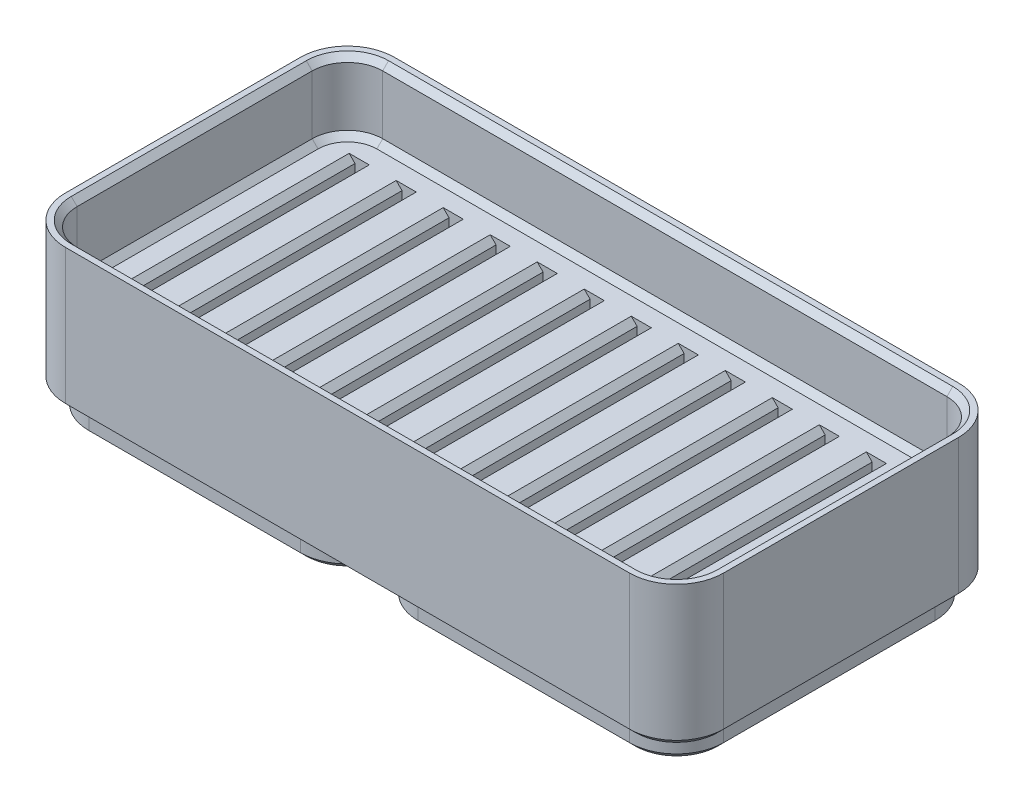
from build123d import *

# Parameters (mm, degrees)
BOSS_EXTRUDE4_DEPTH = 5
SKETCH6_W           = 70
SKETCH6_H           = 70
BOSS_EXTRUDE5_DEPTH = 30
SKETCH8_R           = 3
CUT_EXTRUDE1_DEPTH  = 2
CUT_EXTRUDE2_START  = -30
CUT_EXTRUDE2_DEPTH  = 30
SKETCH10_W          = 140
SKETCH10_H          = 70
BOSS_EXTRUDE6_DEPTH = 2.5
FILLET1_R           = 10
SKETCH11_W          = 202.57423707
SKETCH11_H          = 181.335779968
CUT_EXTRUDE3_DEPTH  = 27.5
SKETCH12_W          = 1.775
SKETCH12_H          = 55
BOSS_EXTRUDE9_DEPTH = 27.5
CUT_EXTRUDE4_DEPTH  = 15
CHAMFER2_SIZE       = 1.25
CHAMFER4_SIZE       = 1.25
CHAMFER5_SIZE       = 1.25


with BuildPart() as part:
    # Sketch5 → Boss-Extrude4 (new body)
    with BuildSketch(Plane(origin=(0, 0, 0), x_dir=(1, 0, 0), z_dir=(0, 1, 0))):
        with BuildLine():
            Line((-22.5, -32.5), (22.5, -32.5))
            ThreePointArc((22.5, -32.5), (29.571067812, -29.571067812), (32.5, -22.5))
            Line((32.5, -22.5), (32.5, 22.5))
            ThreePointArc((32.5, 22.5), (29.571067812, 29.571067812), (22.5, 32.5))
            Line((22.5, 32.5), (-22.5, 32.5))
            ThreePointArc((-22.5, 32.5), (-29.571067812, 29.571067812), (-32.5, 22.5))
            Line((-32.5, 22.5), (-32.5, -22.5))
            ThreePointArc((-32.5, -22.5), (-29.571067812, -29.571067812), (-22.5, -32.5))
        make_face()
    extrude(amount=BOSS_EXTRUDE4_DEPTH)

    # Sketch6 → Boss-Extrude5 (add)
    with BuildSketch(Plane(origin=(0, 5, 0), x_dir=(1, 0, 0), z_dir=(0, 1, 0))):
        Rectangle(SKETCH6_W, SKETCH6_H)
    extrude(amount=BOSS_EXTRUDE5_DEPTH)

    # Sketch8 → Cut-Extrude1 (cut)
    with BuildSketch(Plane.XZ):
        with Locations(Location((26.037533906, -26.035533906, 0), (0, 0, 270))):
            Circle(SKETCH8_R)
        with Locations(Location((26.036533906, 26.036533906, 0), (0, 0, 270))):
            Circle(SKETCH8_R)
        with BuildLine():
            ThreePointArc((-23.035533906, 26.035533906), (-24.887483609, 28.807172503), (-28.156854249, 28.156854249))
            Line((-28.156854249, 28.156854249), (-23.914213562, 23.914213562))
            ThreePointArc((-23.914213562, 23.914213562), (-23.263895308, 24.887483609), (-23.035533906, 26.035533906))
        make_face()
        with BuildLine():
            Line((-23.914213562, 23.914213562), (-28.156854249, 28.156854249))
            ThreePointArc((-28.156854249, 28.156854249), (-28.156854249, 23.914213562), (-23.914213562, 23.914213562))
        make_face()
        with Locations(Location((-26.034533906, -26.036533906, 0), (0, 0, 270))):
            Circle(SKETCH8_R)
    extrude(amount=-CUT_EXTRUDE1_DEPTH, mode=Mode.SUBTRACT)

    # Mirror1: part across plane


with BuildPart() as part_1:
    add(part.part)
    add(part.part.mirror(Plane(origin=(-35, 35, -35), x_dir=(0, 0, 1), z_dir=(1, 0, 0))))

    # Sketch9 → Cut-Extrude2 (cut)
    with BuildSketch(Plane(origin=(0, 35, 0), x_dir=(1, 0, 0), z_dir=(0, 1, 0)).offset(CUT_EXTRUDE2_START)):
        with BuildLine():
            Line((22.5, 32.5), (-92.5, 32.5))
            ThreePointArc((-92.5, 32.5), (-99.571067812, 29.571067812), (-102.5, 22.5))
            Line((-102.5, 22.5), (-102.5, -22.5))
            ThreePointArc((-102.5, -22.5), (-99.571067812, -29.571067812), (-92.5, -32.5))
            Line((-92.5, -32.5), (22.5, -32.5))
            ThreePointArc((22.5, -32.5), (29.571067812, -29.571067812), (32.5, -22.5))
            Line((32.5, -22.5), (32.5, 22.5))
            ThreePointArc((32.5, 22.5), (29.571067812, 29.571067812), (22.5, 32.5))
        make_face()
    extrude(amount=CUT_EXTRUDE2_DEPTH, mode=Mode.SUBTRACT)


with BuildPart() as cut_extrude2_piece_1:
    # of the separate pieces the step leaves, piece 1, a body of its own (cut_extrude2_pieces)
    add(part_1.part.solids().sort_by_distance((35, 5, -35))[0])



with BuildPart() as cut_extrude2_piece_2:
    # of the separate pieces the step leaves, piece 2, a body of its own (cut_extrude2_pieces)
    add(part_1.part.solids().sort_by_distance((-22.5, 0, 32.5))[0])


with BuildPart() as cut_extrude2_piece_3:
    # of the separate pieces the step leaves, piece 3, a body of its own (cut_extrude2_pieces)
    add(part_1.part.solids().sort_by_distance((-92.5, 0, -32.5))[0])


with BuildPart() as cut_extrude2_piece_1_1:
    add(cut_extrude2_piece_1.part)

    add(cut_extrude2_piece_2.part)  # Boss-Extrude6 merges Cut-Extrude2 piece 2

    add(cut_extrude2_piece_3.part)  # Boss-Extrude6 merges Cut-Extrude2 piece 3
    # Sketch10 → Boss-Extrude6 (add)
    with BuildSketch(Plane.XZ.offset(-5)):
        with Locations((-35, 0)):
            Rectangle(SKETCH10_W, SKETCH10_H)
    extrude(amount=-BOSS_EXTRUDE6_DEPTH)

    # Fillet1
    fillet1_edges = [cut_extrude2_piece_1_1.edges().sort_by_distance(p)[0] for p in [
        (35, 20, 35),
        (35, 20, -35),
        (-105, 20, 35),
        (-105, 20, -35),
    ]]
    fillet(fillet1_edges, radius=FILLET1_R)

    # Sketch11 → Cut-Extrude3 (cut)
    with BuildSketch(Plane(origin=(0, 35, 0), x_dir=(1, 0, 0), z_dir=(0, 1, 0))):
        with Locations((-35, 32.5)):
            Rectangle(SKETCH11_W, SKETCH11_H)
    extrude(amount=-CUT_EXTRUDE3_DEPTH, mode=Mode.SUBTRACT)

    # Sketch12 → Boss-Extrude9 (add)
    with BuildSketch(Plane(origin=(0, 7.5, 0), x_dir=(1, 0, 0), z_dir=(0, 1, 0))):
        with BuildLine():
            Line((-105, 25), (-105, -25))
            ThreePointArc((-105, -25), (-102.071067812, -32.071067812), (-95, -35))
            Line((-95, -35), (25, -35))
            ThreePointArc((25, -35), (32.071067812, -32.071067812), (35, -25))
            Line((35, -25), (35, 25))
            ThreePointArc((35, 25), (32.071067812, 32.071067812), (25, 35))
            Line((25, 35), (-95, 35))
            ThreePointArc((-95, 35), (-102.071067812, 32.071067812), (-105, 25))
        make_face()
        with Locations((-85, 0)):
            Rectangle(SKETCH12_W, SKETCH12_H, mode=Mode.SUBTRACT)
        with Locations((-75, 0)):
            Rectangle(SKETCH12_W, SKETCH12_H, mode=Mode.SUBTRACT)
        with Locations((-65, 0)):
            Rectangle(SKETCH12_W, SKETCH12_H, mode=Mode.SUBTRACT)
        with Locations((-55, 0)):
            Rectangle(SKETCH12_W, SKETCH12_H, mode=Mode.SUBTRACT)
        with Locations((-45, 0)):
            Rectangle(SKETCH12_W, SKETCH12_H, mode=Mode.SUBTRACT)
        with Locations((-35, 0)):
            Rectangle(SKETCH12_W, SKETCH12_H, mode=Mode.SUBTRACT)
        with Locations((-95, 0)):
            Rectangle(SKETCH12_W, SKETCH12_H, mode=Mode.SUBTRACT)
        with Locations((-25, 0)):
            Rectangle(SKETCH12_W, SKETCH12_H, mode=Mode.SUBTRACT)
        with Locations((-15, 0)):
            Rectangle(SKETCH12_W, SKETCH12_H, mode=Mode.SUBTRACT)
        with Locations((-5, 0)):
            Rectangle(SKETCH12_W, SKETCH12_H, mode=Mode.SUBTRACT)
        with Locations((5, 0)):
            Rectangle(SKETCH12_W, SKETCH12_H, mode=Mode.SUBTRACT)
        with Locations((15, 0)):
            Rectangle(SKETCH12_W, SKETCH12_H, mode=Mode.SUBTRACT)
        with Locations((25, 0)):
            Rectangle(SKETCH12_W, SKETCH12_H, mode=Mode.SUBTRACT)
    extrude(amount=BOSS_EXTRUDE9_DEPTH)

    # Sketch13 → Cut-Extrude4 (cut)
    with BuildSketch(Plane(origin=(0, 35, 0), x_dir=(1, 0, 0), z_dir=(0, 1, 0))):
        with BuildLine():
            Line((32.5, -25), (32.5, 25))
            ThreePointArc((32.5, 25), (30.303300859, 30.303300859), (25, 32.5))
            Line((25, 32.5), (-95, 32.5))
            ThreePointArc((-95, 32.5), (-100.303300859, 30.303300859), (-102.5, 25))
            Line((-102.5, 25), (-102.5, -25))
            ThreePointArc((-102.5, -25), (-100.303300859, -30.303300859), (-95, -32.5))
            Line((-95, -32.5), (25, -32.5))
            ThreePointArc((25, -32.5), (30.303300859, -30.303300859), (32.5, -25))
        make_face()
    extrude(amount=-CUT_EXTRUDE4_DEPTH, mode=Mode.SUBTRACT)

    # Chamfer2
    chamfer2_edges = [cut_extrude2_piece_1_1.edges().sort_by_distance(p)[0] for p in [
        (30.303300859, 20, -30.303300859),
        (32.5, 20, 0),
        (30.303300859, 20, 30.303300859),
        (-35, 20, 32.5),
        (-100.303300859, 20, 30.303300859),
        (-102.5, 20, 0),
        (-100.303300859, 20, -30.303300859),
        (-35, 20, -32.5),
        (30.303300859, 35, -30.303300859),
        (-35, 35, -32.5),
        (-100.303300859, 35, -30.303300859),
        (-102.5, 35, 0),
        (-100.303300859, 35, 30.303300859),
        (-35, 35, 32.5),
        (30.303300859, 35, 30.303300859),
        (32.5, 35, 0),
    ]]
    chamfer(chamfer2_edges, length=CHAMFER2_SIZE)

    # Chamfer4
    chamfer4_edges = [cut_extrude2_piece_1_1.edges().sort_by_distance(p)[0] for p in [
        (-29.571067812, 0, 29.571067812),
        (0, 0, 32.5),
        (29.571067812, 0, 29.571067812),
        (32.5, 0, 0),
        (29.571067812, 0, -29.571067812),
        (0, 0, -32.5),
        (-29.571067812, 0, -29.571067812),
        (-32.5, 0, 0),
        (-40.428932188, 0, 29.571067812),
        (-70, 0, 32.5),
        (-99.571067812, 0, 29.571067812),
        (-102.5, 0, 0),
        (-99.571067812, 0, -29.571067812),
        (-70, 0, -32.5),
        (-40.428932188, 0, -29.571067812),
        (-37.5, 0, 0),
        (-35, 5, -35),
        (-35, 5, 35),
        (-105, 5, 0),
        (35, 5, 0),
        (-102.071067812, 5, -32.071067812),
        (-102.071067812, 5, 32.071067812),
        (32.071067812, 5, 32.071067812),
        (32.071067812, 5, -32.071067812),
    ]]
    chamfer(chamfer4_edges, length=CHAMFER4_SIZE)

    # Chamfer5
    chamfer5_edges = [cut_extrude2_piece_1_1.edges().sort_by_distance(p)[0] for p in [
        (25.8875, 20, 0),
        (-94.1125, 20, 0),
        (-95.8875, 20, 0),
        (-84.1125, 20, 0),
        (-85.8875, 20, 0),
        (-74.1125, 20, 0),
        (-75.8875, 20, 0),
        (-64.1125, 20, 0),
        (-65.8875, 20, 0),
        (-54.1125, 20, 0),
        (-55.8875, 20, 0),
        (-44.1125, 20, 0),
        (-45.8875, 20, 0),
        (-34.1125, 20, 0),
        (-35.8875, 20, 0),
        (-24.1125, 20, 0),
        (-25.8875, 20, 0),
        (-14.1125, 20, 0),
        (-15.8875, 20, 0),
        (-4.1125, 20, 0),
        (-5.8875, 20, 0),
        (5.8875, 20, 0),
        (4.1125, 20, 0),
        (15.8875, 20, 0),
        (14.1125, 20, 0),
        (24.1125, 20, 0),
    ]]
    chamfer(chamfer5_edges, length=CHAMFER5_SIZE)


solid = cut_extrude2_piece_1_1.part
